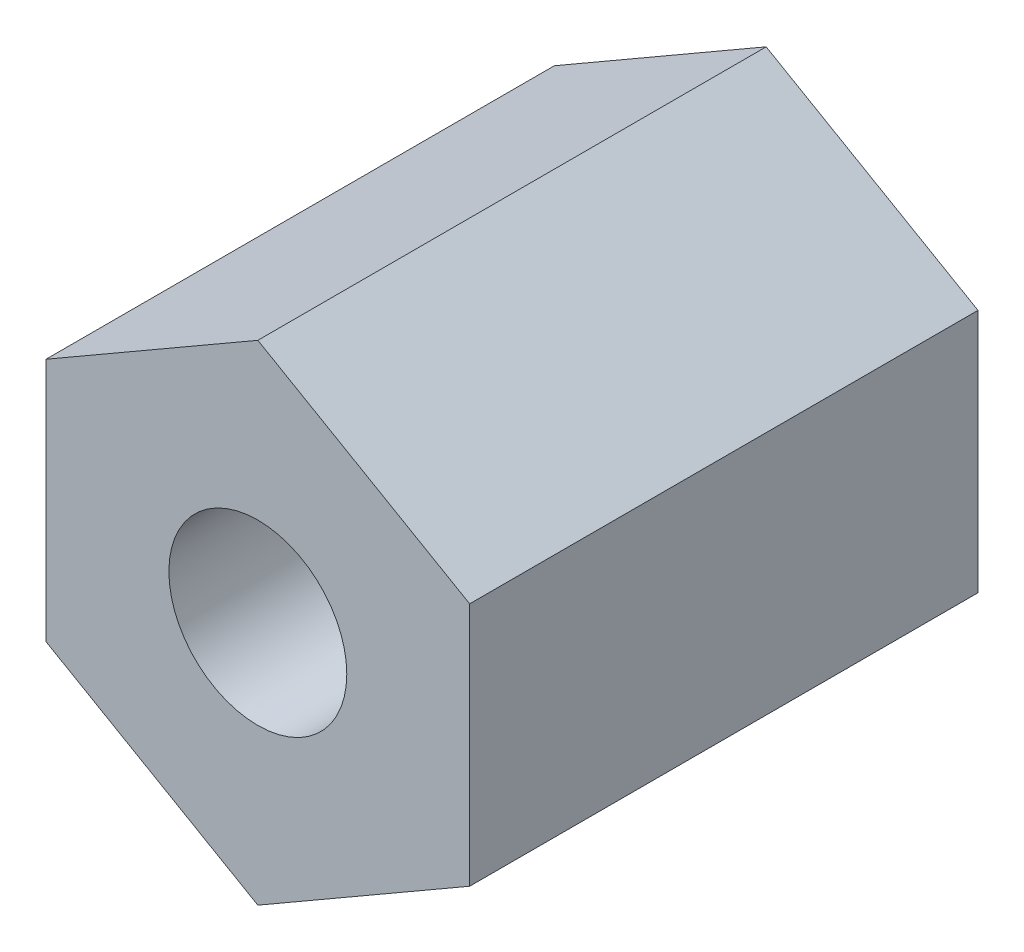
from build123d import *

# Parameters (mm, degrees)
HEX_5_START      = 12.7
HEX_5_DEPTH      = 6
ROSCA_M2_5_START = 12.7
CROQUIS2_R       = 1.05
ROSCA_M2_5_DEPTH = 6


with BuildPart() as part:
    # Croquis1 → Hex_5 (new body)
    with BuildSketch(Plane.XY.offset(HEX_5_START)):
        Polygon((-105.999784659, -54.5565), (-108.5, -53.113), (-111.000215341, -54.5565), (-111.000215341, -57.4435), (-108.5, -58.887), (-105.999784659, -57.4435), align=None)
    extrude(amount=HEX_5_DEPTH)

    # Croquis2 → Rosca_M2-5 (cut)
    with BuildSketch(Plane.XY.offset(ROSCA_M2_5_START)):
        with Locations((-108.5, -56)):
            Circle(CROQUIS2_R)
    extrude(amount=ROSCA_M2_5_DEPTH, mode=Mode.SUBTRACT)


solid = part.part
